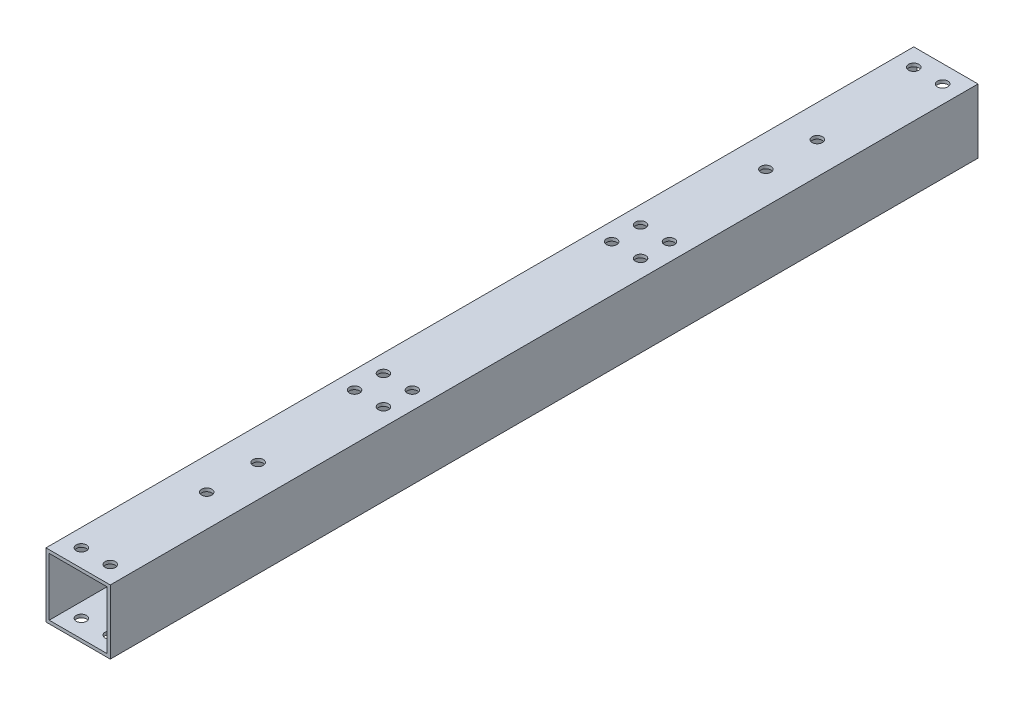
from build123d import *

# Parameters (mm, degrees)
SKETCH_1_W          = 20
SKETCH_1_H          = 20
SKETCH_1_W_2        = 18
SKETCH_1_H_2        = 18
EXTRUDE_1_DEPTH     = 270
SKETCH_2_R          = 1.6
CUT_EXTRUDE_1_DEPTH = 271.924343683
CUT_EXTRUDE_2_REACH = 272.924
SKETCH_3_W          = 18
SKETCH_3_H          = 18
SKETCH_4_R          = 1.6
CUT_EXTRUDE_3_DEPTH = 271.924343683
SKETCH_5_R          = 1.6
CUT_EXTRUDE_4_DEPTH = 271.924343683


with BuildPart() as part:
    # 草图1 → 凸台-拉伸1 (new body)
    with BuildSketch(Plane.XY):
        Rectangle(SKETCH_1_W, SKETCH_1_H)
        Rectangle(SKETCH_1_W_2, SKETCH_1_H_2, mode=Mode.SUBTRACT)
    extrude(amount=EXTRUDE_1_DEPTH)

    # 草图2 → 切除-拉伸1 (cut, through all)
    with BuildSketch(Plane(origin=(0, 10, 0), x_dir=(1, 0, 0), z_dir=(0, 1, 0))):
        with Locations(Location((-4.5, -179.5, 0), (0, 0, 270))):
            Circle(SKETCH_2_R)
        with Locations(Location((4.5, -179.5, 0), (0, 0, 270))):
            Circle(SKETCH_2_R)
        with Locations(Location((4.5, -170.5, 0), (0, 0, 270))):
            Circle(SKETCH_2_R)
        with Locations(Location((-4.5, -170.5, 0), (0, 0, 270))):
            Circle(SKETCH_2_R)
        with Locations(Location((-4.5, -99.5, 0), (0, 0, 270))):
            Circle(SKETCH_2_R)
        with Locations(Location((4.5, -90.5, 0), (0, 0, 270))):
            Circle(SKETCH_2_R)
        with Locations(Location((4.5, -99.5, 0), (0, 0, 270))):
            Circle(SKETCH_2_R)
        with Locations(Location((-4.5, -90.5, 0), (0, 0, 270))):
            Circle(SKETCH_2_R)
    extrude(amount=-CUT_EXTRUDE_1_DEPTH, mode=Mode.SUBTRACT)

    # 草图3 → 切除-拉伸2 (cut, up to next)
    with BuildSketch(Plane.XZ.offset(10), mode=Mode.PRIVATE) as cut_extrude_2_sk1:
        with Locations((0, 175)):
            Rectangle(SKETCH_3_W, SKETCH_3_H)
    cut_extrude_2_tool1 = extrude(cut_extrude_2_sk1.sketch, amount=-CUT_EXTRUDE_2_REACH, mode=Mode.PRIVATE) & part.part
    # 草图3 → 切除-拉伸2 (cut, up to next)
    with BuildSketch(Plane.XZ.offset(10), mode=Mode.PRIVATE) as cut_extrude_2_sk2:
        with Locations((0, 95)):
            Rectangle(SKETCH_3_W, SKETCH_3_H)
    cut_extrude_2_tool2 = extrude(cut_extrude_2_sk2.sketch, amount=-CUT_EXTRUDE_2_REACH, mode=Mode.PRIVATE) & part.part
    add(cut_extrude_2_tool1.solids().sort_by_distance((0, -10, 175))[0], mode=Mode.SUBTRACT)
    add(cut_extrude_2_tool2.solids().sort_by_distance((0, -10, 95))[0], mode=Mode.SUBTRACT)

    # 草图4 → 切除-拉伸3 (cut, through all)
    with BuildSketch(Plane(origin=(0, 10, 0), x_dir=(1, 0, 0), z_dir=(0, 1, 0))):
        with Locations(Location((-4.5, -5.5, 0), (0, 0, 270))):
            Circle(SKETCH_4_R)
        with Locations(Location((4.5, -5.5, 0), (0, 0, 270))):
            Circle(SKETCH_4_R)
        with Locations(Location((-4.5, -264.5, 0), (0, 0, 270))):
            Circle(SKETCH_4_R)
        with Locations(Location((4.5, -264.5, 0), (0, 0, 90))):
            Circle(SKETCH_4_R)
    extrude(amount=-CUT_EXTRUDE_3_DEPTH, mode=Mode.SUBTRACT)

    # 草图5 → 切除-拉伸4 (cut, through all)
    with BuildSketch(Plane.XZ.offset(10)):
        with Locations(Location((0, 56, 0), (0, 0, 270))):
            Circle(SKETCH_5_R)
        with Locations(Location((0, 40, 0), (0, 0, 270))):
            Circle(SKETCH_5_R)
    cut_extrude_4 = extrude(amount=-CUT_EXTRUDE_4_DEPTH, mode=Mode.SUBTRACT)

    # 镜向1: 切除-拉伸4 across plane
    add(cut_extrude_4.mirror(Plane(origin=(0, 0, 135), x_dir=(1, 0, 0), z_dir=(0, 0, -1))), mode=Mode.SUBTRACT)


solid = part.part
